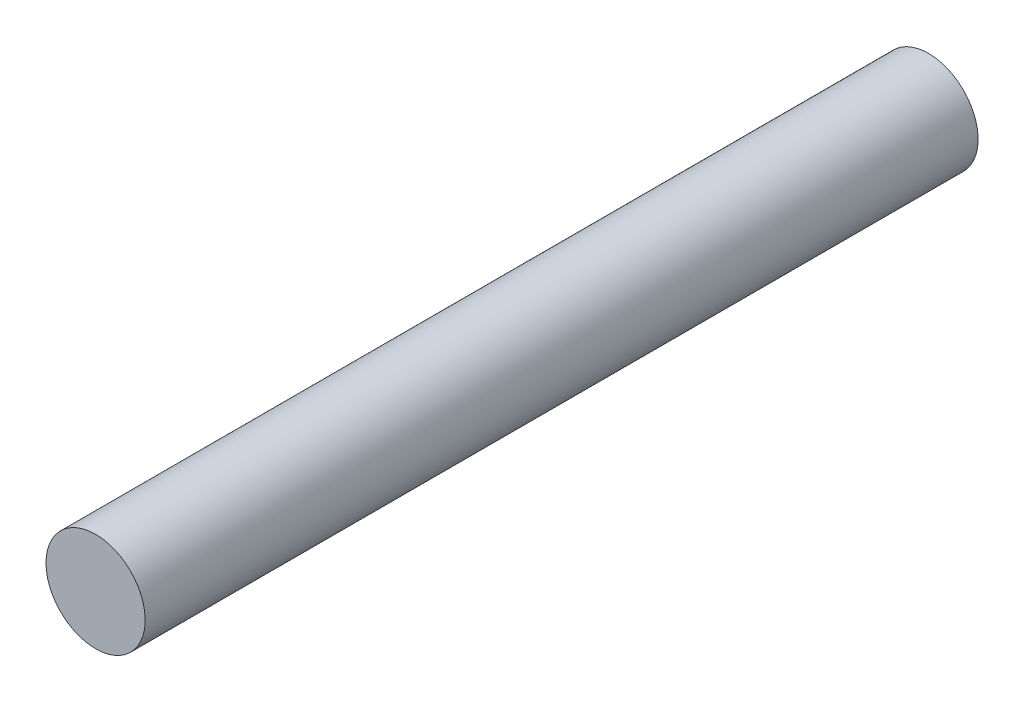
from build123d import *

# Parameters (mm, degrees)
SKETCH1_R           = 5
BOSS_EXTRUDE1_DEPTH = 84


with BuildPart() as part:
    # Sketch1 → Boss-Extrude1 (new body)
    with BuildSketch(Plane.XY):
        with Locations(Location((0, 0, 0), (0, 0, 180))):
            Circle(SKETCH1_R)
    extrude(amount=BOSS_EXTRUDE1_DEPTH)


solid = part.part
